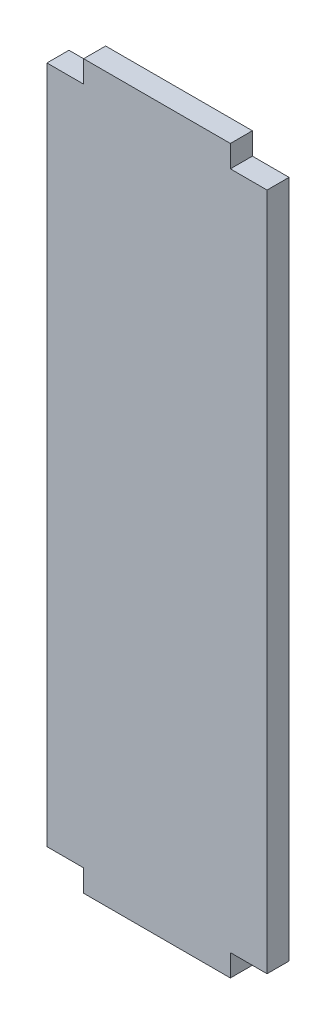
from build123d import *

# Parameters (mm, degrees)
BOSS_EXTRUDE1_DEPTH = 6


with BuildPart() as part:
    # Sketch1 → Boss-Extrude1 (new body)
    with BuildSketch(Plane.XY):
        Polygon((-30, 92.5), (-30, -92.5), (-20, -92.5), (-20, -98.5), (20, -98.5), (20, -92.5), (30, -92.5), (30, 92.5), (20, 92.5), (20, 98.5), (-20, 98.5), (-20, 92.5), align=None)
    extrude(amount=BOSS_EXTRUDE1_DEPTH)


solid = part.part
